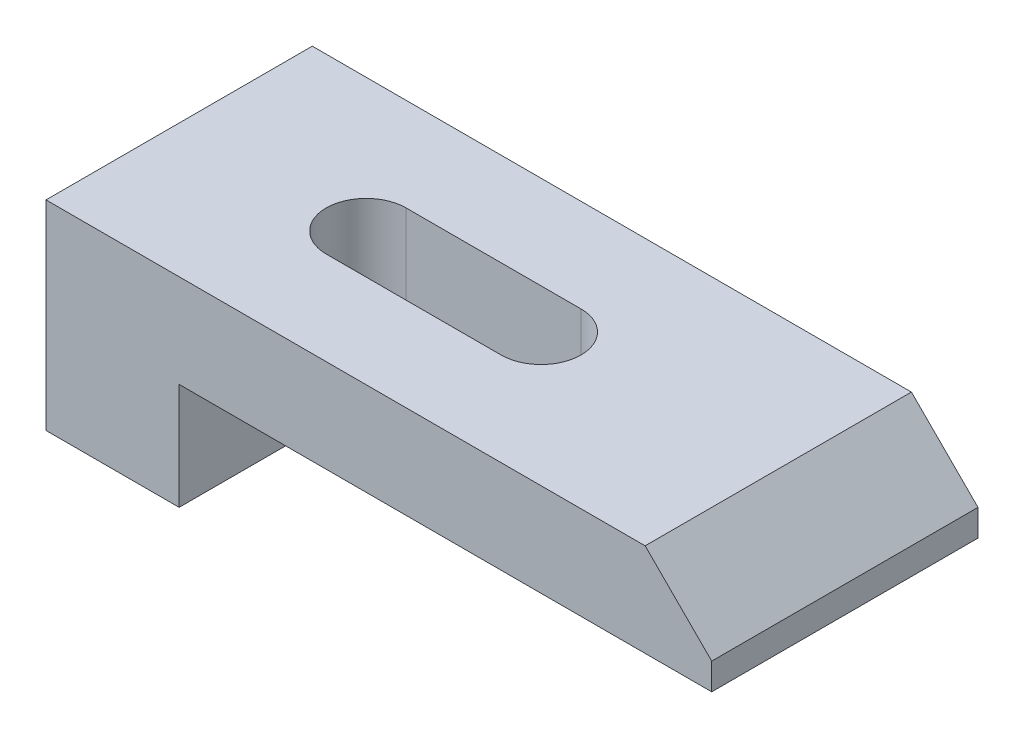
from build123d import *

# Parameters (mm, degrees)
BOSS_EXTRUDE1_DEPTH = 20
CHAMFER1_SIZE       = 5
CUT_EXTRUDE1_DEPTH  = 20


with BuildPart() as part:
    # Sketch1 → Boss-Extrude1 (new body)
    with BuildSketch(Plane.XY):
        Polygon((0, 15), (0, 8), (-40, 8), (-40, 0), (-50, 0), (-50, 15), align=None)
    extrude(amount=BOSS_EXTRUDE1_DEPTH)

    # Chamfer1
    chamfer1_edges = [part.edges().sort_by_distance(p)[0] for p in [
        (0, 15, 10),
    ]]
    chamfer(chamfer1_edges, length=CHAMFER1_SIZE)

    # Sketch2 → Cut-Extrude1 (cut)
    with BuildSketch(Plane(origin=(0, 15, 0), x_dir=(1, 0, 0), z_dir=(0, 1, 0))):
        with BuildLine():
            Line((-35.955322897, -7), (-22.818363887, -7))
            ThreePointArc((-22.818363887, -7), (-19.818363887, -10), (-22.818363887, -13))
            Line((-22.818363887, -13), (-35.955322897, -13))
            ThreePointArc((-35.955322897, -13), (-38.955322897, -10), (-35.955322897, -7))
        make_face()
    extrude(amount=-CUT_EXTRUDE1_DEPTH, mode=Mode.SUBTRACT)


solid = part.part
